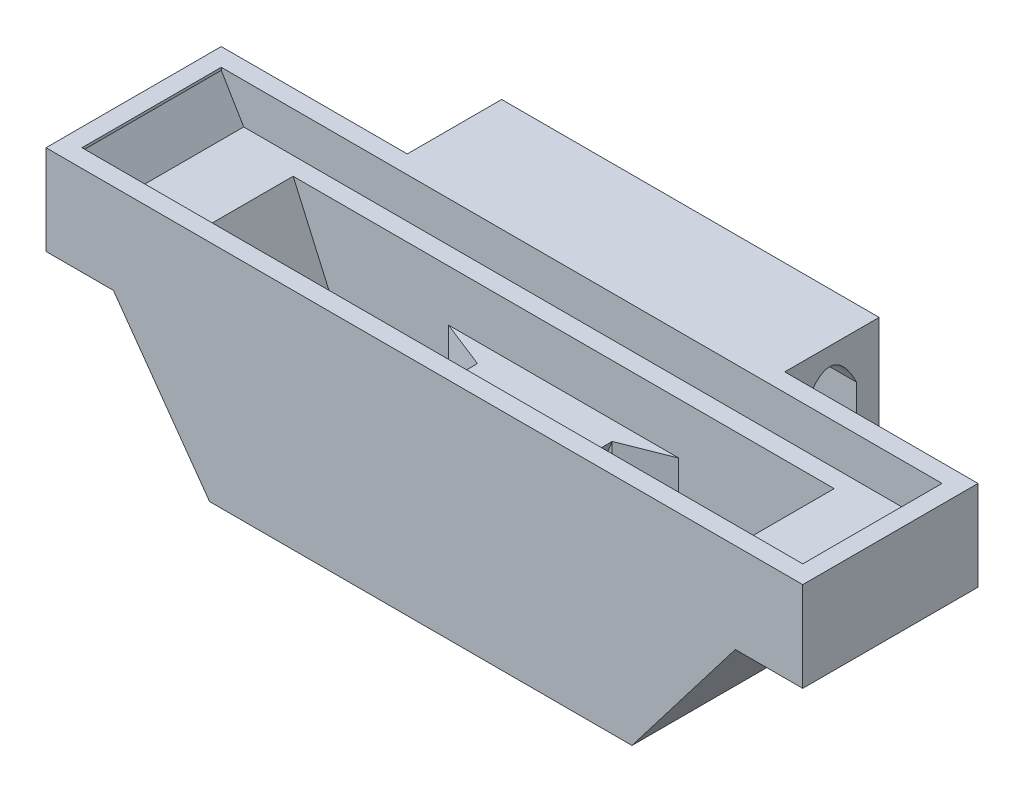
from build123d import *

# Parameters (mm, degrees)
SKETCH1_W            = 213.868
SKETCH1_H            = 49.53
BOSS_EXTRUDE1_DEPTH  = 63.5
SKETCH2_W            = 203.708
SKETCH2_H            = 39.37
CUT_EXTRUDE1_DEPTH   = 11.43
SKETCH3_W            = 191.008
SKETCH3_H            = 29.21
CUT_EXTRUDE2_DEPTH   = 45.72
SKETCH5_W            = 29.21
SKETCH5_H            = 45.72
BOSS_EXTRUDE2_DEPTH  = 31.75
SKETCH7_W            = 29.21
SKETCH7_H            = 45.802108617
BOSS_EXTRUDE3_DEPTH  = 31.75
BOSS_EXTRUDE4_DEPTH  = 40.64
BOSS_EXTRUDE5_DEPTH  = 40.64
SKETCH20_W           = 12.7
SKETCH20_H           = 29.21
BOSS_EXTRUDE6_DEPTH  = 18.542
BOSS_EXTRUDE7_DEPTH  = 30.48
SKETCH22_W           = 106.68
SKETCH22_H           = 63.5
BOSS_EXTRUDE8_DEPTH  = 26.67
CUT_EXTRUDE11_DEPTH  = 96.52
CUT_EXTRUDE5_DEPTH   = 49.53
SKETCH28_W           = 12.7
SKETCH28_H           = 29.21
CUT_EXTRUDE6_DEPTH   = 28.702
BOSS_EXTRUDE9_DEPTH  = 29.21
SKETCH30_W           = 12.7
SKETCH30_H           = 29.21
CUT_EXTRUDE7_DEPTH   = 28.702
BOSS_EXTRUDE11_DEPTH = 29.21
BOSS_EXTRUDE12_DEPTH = 29.21
CUT_EXTRUDE8_DEPTH   = 49.53
BOSS_EXTRUDE13_DEPTH = 29.21
CUT_EXTRUDE9_DEPTH   = 50.8
CUT_EXTRUDE12_DEPTH  = 49.53
SKETCH48_W           = 12.7
SKETCH48_H           = 5.334
BOSS_EXTRUDE14_DEPTH = 31.242
BOSS_EXTRUDE17_DEPTH = 31.242
SKETCH52_W           = 12.7
SKETCH52_H           = 5.334
BOSS_EXTRUDE18_DEPTH = 31.242
BOSS_EXTRUDE19_DEPTH = 31.242
SKETCH54_W           = 12.7
SKETCH54_H           = 5.334
BOSS_EXTRUDE20_DEPTH = 31.242
BOSS_EXTRUDE21_DEPTH = 31.242
SKETCH56_W           = 12.7
SKETCH56_H           = 5.334
BOSS_EXTRUDE22_DEPTH = 31.242
BOSS_EXTRUDE23_DEPTH = 31.242


with BuildPart() as part:
    # Sketch1 → Boss-Extrude1 (new body)
    with BuildSketch(Plane(origin=(0, 0, 0), x_dir=(1, 0, 0), z_dir=(0, 1, 0))):
        with Locations((47.373649513, -17.485904033)):
            Rectangle(SKETCH1_W, SKETCH1_H)
    extrude(amount=BOSS_EXTRUDE1_DEPTH)

    # Sketch2 → Cut-Extrude1 (cut)
    with BuildSketch(Plane(origin=(0, 63.5, 0), x_dir=(1, 0, 0), z_dir=(0, 1, 0))):
        with Locations((47.373649513, -17.485904033)):
            Rectangle(SKETCH2_W, SKETCH2_H)
    extrude(amount=-CUT_EXTRUDE1_DEPTH, mode=Mode.SUBTRACT)

    # Sketch3 → Cut-Extrude2 (cut)
    with BuildSketch(Plane(origin=(0, 52.07, 0), x_dir=(1, 0, 0), z_dir=(0, 1, 0))):
        with Locations((47.373649513, -17.485904033)):
            Rectangle(SKETCH3_W, SKETCH3_H)
    extrude(amount=-CUT_EXTRUDE2_DEPTH, mode=Mode.SUBTRACT)

    # Sketch5 → Boss-Extrude2 (add)
    with BuildSketch(Plane.ZY.offset(-142.877649513)):
        with Locations((17.485904033, 29.21)):
            Rectangle(SKETCH5_W, SKETCH5_H)
    extrude(amount=BOSS_EXTRUDE2_DEPTH)

    # Sketch7 → Boss-Extrude3 (add)
    with BuildSketch(Plane(origin=(-48.130350487, 0, 0), x_dir=(0, 0, -1), z_dir=(1, 0, 0))):
        with Locations((-17.485904033, 29.168945691)):
            Rectangle(SKETCH7_W, SKETCH7_H)
    extrude(amount=BOSS_EXTRUDE3_DEPTH)

    # Sketch13 → Boss-Extrude4 (add)
    with BuildSketch(Plane.XY.offset(-2.199095967)):
        Polygon((-54.480350487, 62.738), (-48.130350487, 52.07), (-54.480350487, 52.07), align=None)
    extrude(amount=BOSS_EXTRUDE4_DEPTH)

    # Sketch19 → Boss-Extrude5 (add)
    with BuildSketch(Plane(origin=(0, 0, 37.170904033), x_dir=(-1, 0, 0), z_dir=(0, 0, -1))):
        Polygon((-149.227649513, 62.738), (-142.877649513, 52.07), (-149.227649513, 52.07), align=None)
    extrude(amount=BOSS_EXTRUDE5_DEPTH)

    # Sketch20 → Boss-Extrude6 (add)
    with BuildSketch(Plane(origin=(0, 6.35, 0), x_dir=(1, 0, 0), z_dir=(0, 1, 0))):
        with Locations((47.373649513, -17.485904033)):
            Rectangle(SKETCH20_W, SKETCH20_H)
    extrude(amount=BOSS_EXTRUDE6_DEPTH)

    # Sketch21 → Boss-Extrude7 (add)
    with BuildSketch(Plane.XY.offset(2.880904033)):
        Polygon((66.423649513, 37.592), (28.323649513, 37.592), (33.403649513, 24.892), (41.023649513, 24.892), (53.723649513, 24.892), (61.343649513, 24.892), align=None)
    extrude(amount=BOSS_EXTRUDE7_DEPTH)

    # Sketch22 → Boss-Extrude8 (add)
    with BuildSketch(Plane(origin=(0, 0, -7.279095967), x_dir=(-1, 0, 0), z_dir=(0, 0, -1))):
        with Locations((-46.357649513, 31.75)):
            Rectangle(SKETCH22_W, SKETCH22_H)
    extrude(amount=BOSS_EXTRUDE8_DEPTH)

    # Sketch39 → Cut-Extrude11 (cut)
    with BuildSketch(Plane(origin=(99.697649513, 0, 0), x_dir=(0, 0, -1), z_dir=(1, 0, 0))):
        with BuildLine():
            add(Edge.make_bspline(
                [(12.359095967, 50.8), (19.979095967, 66.04), (27.599095967, 50.8)],
                knots=[0, 0, 0, 1, 1, 1], degree=2))
            Line((12.359095967, 50.8), (12.359095967, 6.35))
            Line((12.359095967, 6.35), (13.629095967, 6.35))
            Line((13.629095967, 6.35), (26.329095967, 6.35))
            Line((26.329095967, 6.35), (27.599095967, 6.35))
            Line((27.599095967, 6.35), (27.599095967, 50.8))
        make_face()
    extrude(amount=-CUT_EXTRUDE11_DEPTH, mode=Mode.SUBTRACT)

    # Sketch26 → Cut-Extrude5 (cut)
    with BuildSketch(Plane(origin=(0, 0, -7.279095967), x_dir=(-1, 0, 0), z_dir=(0, 0, -1))):
        Polygon((-154.307649513, 38.1), (-106.047649513, 0), (-154.307649513, 0), align=None)
    extrude(amount=-CUT_EXTRUDE5_DEPTH, mode=Mode.SUBTRACT)

    # Sketch28 → Cut-Extrude6 (cut)
    with BuildSketch(Plane(origin=(0, 52.07, 0), x_dir=(1, 0, 0), z_dir=(0, 1, 0))):
        with Locations((117.477649513, -17.485904033)):
            Rectangle(SKETCH28_W, SKETCH28_H)
    extrude(amount=-CUT_EXTRUDE6_DEPTH, mode=Mode.SUBTRACT)

    # Sketch29 → Boss-Extrude9 (add)
    with BuildSketch(Plane(origin=(0, 0, 32.090904033), x_dir=(-1, 0, 0), z_dir=(0, 0, -1))):
        Polygon((-123.827649513, 52.07), (-111.127649513, 23.368), (-123.827649513, 23.368), align=None)
    extrude(amount=BOSS_EXTRUDE9_DEPTH)

    # Sketch30 → Cut-Extrude7 (cut)
    with BuildSketch(Plane(origin=(0, 52.07, 0), x_dir=(1, 0, 0), z_dir=(0, 1, 0))):
        with Locations((-22.730350487, -17.485904033)):
            Rectangle(SKETCH30_W, SKETCH30_H)
    extrude(amount=-CUT_EXTRUDE7_DEPTH, mode=Mode.SUBTRACT)

    # Sketch31 → Boss-Extrude11 (add)
    with BuildSketch(Plane(origin=(0, 0, 32.090904033), x_dir=(-1, 0, 0), z_dir=(0, 0, -1))):
        Polygon((16.380350487, 23.368), (29.080350487, 52.07), (29.080350487, 23.368), align=None)
    extrude(amount=BOSS_EXTRUDE11_DEPTH)

    # Sketch33 → Boss-Extrude12 (add)
    with BuildSketch(Plane(origin=(0, 0, 32.090904033), x_dir=(-1, 0, 0), z_dir=(0, 0, -1))):
        Polygon((-111.127649513, 23.368), (-98.427649513, 6.35), (-111.127649513, 6.35), align=None)
    extrude(amount=BOSS_EXTRUDE12_DEPTH)

    # Sketch34 → Cut-Extrude8 (cut)
    with BuildSketch(Plane(origin=(0, 0, -7.279095967), x_dir=(-1, 0, 0), z_dir=(0, 0, -1))):
        Polygon((-154.307649513, 38.1), (-135.257649513, 38.1), (-106.047649513, 0), align=None)
    extrude(amount=-CUT_EXTRUDE8_DEPTH, mode=Mode.SUBTRACT)

    # Sketch35 → Boss-Extrude13 (add)
    with BuildSketch(Plane(origin=(0, 0, 32.090904033), x_dir=(-1, 0, 0), z_dir=(0, 0, -1))):
        Polygon((16.380350487, 23.368), (3.680350487, 6.35), (16.380350487, 6.35), align=None)
    extrude(amount=BOSS_EXTRUDE13_DEPTH)

    # Sketch37 → Cut-Extrude9 (cut)
    with BuildSketch(Plane(origin=(0, 0, -7.279095967), x_dir=(-1, 0, 0), z_dir=(0, 0, -1))):
        Polygon((13.332350487, 0), (59.560350487, 38.1), (59.560350487, 0), align=None)
    extrude(amount=-CUT_EXTRUDE9_DEPTH, mode=Mode.SUBTRACT)

    # Sketch40 → Cut-Extrude12 (cut)
    with BuildSketch(Plane(origin=(0, 0, -7.279095967), x_dir=(-1, 0, 0), z_dir=(0, 0, -1))):
        Polygon((40.510350487, 38.1), (59.560350487, 38.1), (13.332350487, 0), align=None)
    extrude(amount=-CUT_EXTRUDE12_DEPTH, mode=Mode.SUBTRACT)

    # Sketch48 → Boss-Extrude14 (add)
    with BuildSketch(Plane(origin=(0, 6.35, 0), x_dir=(1, 0, 0), z_dir=(0, 1, 0))):
        with Locations((34.673649513, -5.547904033)):
            Rectangle(SKETCH48_W, SKETCH48_H)
    extrude(amount=BOSS_EXTRUDE14_DEPTH)

    # Sketch51 → Boss-Extrude17 (add)
    with BuildSketch(Plane(origin=(0, 6.35, 0), x_dir=(1, 0, 0), z_dir=(0, 1, 0))):
        Polygon((14.861649513, -2.880904033), (28.323649513, -8.214904033), (28.323649513, -2.880904033), align=None)
    extrude(amount=BOSS_EXTRUDE17_DEPTH)

    # Sketch52 → Boss-Extrude18 (add)
    with BuildSketch(Plane(origin=(0, 6.35, 0), x_dir=(1, 0, 0), z_dir=(0, 1, 0))):
        with Locations((34.673649513, -29.423904033)):
            Rectangle(SKETCH52_W, SKETCH52_H)
    extrude(amount=BOSS_EXTRUDE18_DEPTH)

    # Sketch53 → Boss-Extrude19 (add)
    with BuildSketch(Plane(origin=(0, 6.35, 0), x_dir=(1, 0, 0), z_dir=(0, 1, 0))):
        Polygon((14.861649513, -32.090904033), (28.323649513, -26.756904033), (28.323649513, -32.090904033), align=None)
    extrude(amount=BOSS_EXTRUDE19_DEPTH)

    # Sketch54 → Boss-Extrude20 (add)
    with BuildSketch(Plane(origin=(0, 6.35, 0), x_dir=(1, 0, 0), z_dir=(0, 1, 0))):
        with Locations((60.073649513, -5.547904033)):
            Rectangle(SKETCH54_W, SKETCH54_H)
    extrude(amount=BOSS_EXTRUDE20_DEPTH)

    # Sketch55 → Boss-Extrude21 (add)
    with BuildSketch(Plane(origin=(0, 6.35, 0), x_dir=(1, 0, 0), z_dir=(0, 1, 0))):
        Polygon((66.423649513, -8.214904033), (79.885649513, -2.880904033), (66.423649513, -2.880904033), align=None)
    extrude(amount=BOSS_EXTRUDE21_DEPTH)

    # Sketch56 → Boss-Extrude22 (add)
    with BuildSketch(Plane(origin=(0, 6.35, 0), x_dir=(1, 0, 0), z_dir=(0, 1, 0))):
        with Locations((60.073649513, -29.423904033)):
            Rectangle(SKETCH56_W, SKETCH56_H)
    extrude(amount=BOSS_EXTRUDE22_DEPTH)

    # Sketch57 → Boss-Extrude23 (add)
    with BuildSketch(Plane(origin=(0, 6.35, 0), x_dir=(1, 0, 0), z_dir=(0, 1, 0))):
        Polygon((66.423649513, -26.756904033), (79.885649513, -32.090904033), (66.423649513, -32.090904033), align=None)
    extrude(amount=BOSS_EXTRUDE23_DEPTH)


solid = part.part
